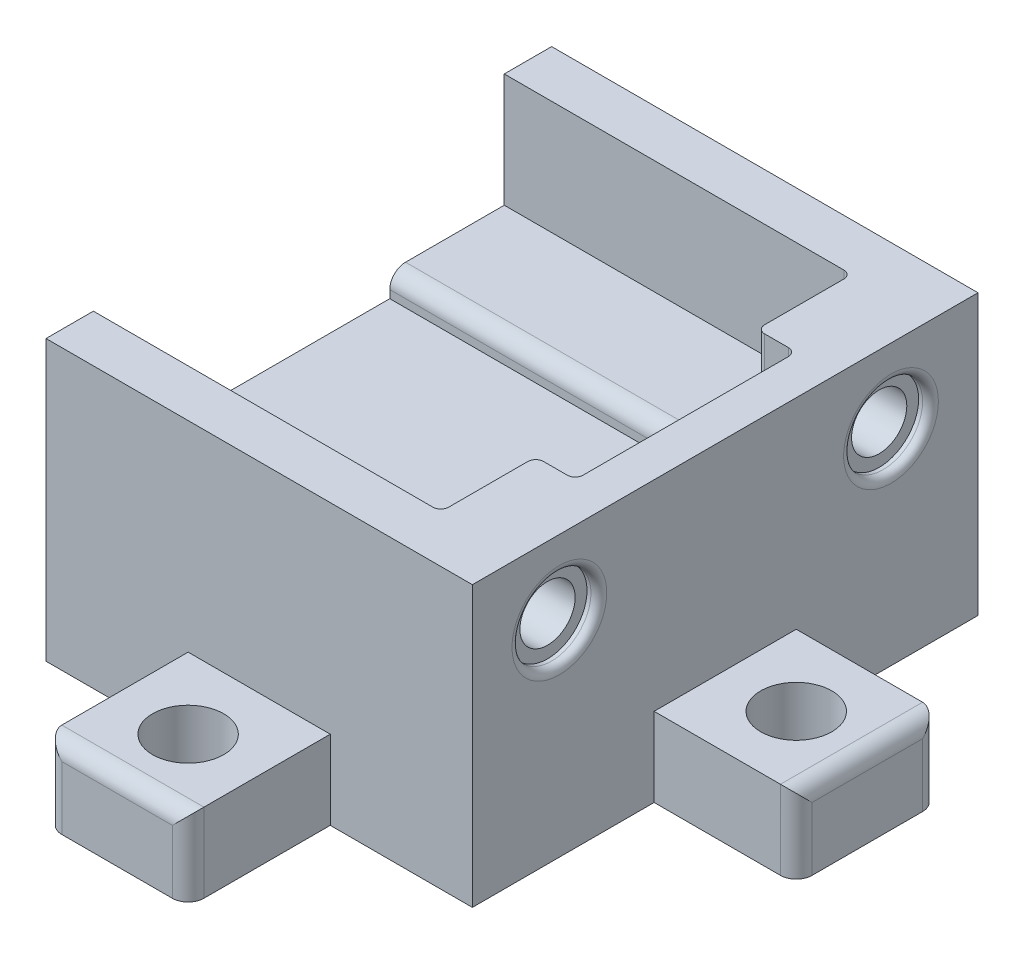
from build123d import *

# Parameters (mm, degrees)
BOSS_EXTRUDE1_DEPTH = 11
SKETCH3_W           = 22
SKETCH3_H           = 3
BOSS_EXTRUDE2_DEPTH = 17.7
BOSS_EXTRUDE3_DEPTH = 5
SKETCH5_R           = 1.75
CUT_EXTRUDE1_DEPTH  = 37.035744466
SKETCH6_W           = 9
SKETCH6_H           = 9
BOSS_EXTRUDE4_DEPTH = 5
SKETCH7_R           = 2.25
CUT_EXTRUDE2_DEPTH  = 38.573063213
FILLET1_R           = 1
SKETCH8_R           = 2.5
CUT_EXTRUDE3_DEPTH  = 0.75
FILLET2_R           = 0.5
SKETCH10_W          = 14
SKETCH10_H          = 7.2
CUT_EXTRUDE4_DEPTH  = 2.5
FILLET3_R           = 0.5


with BuildPart() as part:
    # Sketch1 → Boss-Extrude1 (new, symmetric)
    with BuildSketch(Plane(origin=(0, 0, 0), x_dir=(0, 0, -1), z_dir=(1, 0, 0))):
        Polygon((-13.0089, 0), (13.0089, 0), (13.0089, 10.5), (5.7589, 10.5), (5.7589, 9), (-5.7589, 9), (-5.7589, 10.5), (-13.0089, 10.5), align=None)
    extrude(amount=BOSS_EXTRUDE1_DEPTH, both=True)

    # Sketch3 → Boss-Extrude2 (add)
    with BuildSketch(Plane.XZ):
        with Locations((0, -14.5089)):
            Rectangle(SKETCH3_W, SKETCH3_H)
        with Locations((0, 14.5089)):
            Rectangle(SKETCH3_W, SKETCH3_H)
    extrude(amount=-BOSS_EXTRUDE2_DEPTH)

    # Sketch4 → Boss-Extrude3 (add)
    with BuildSketch(Plane(origin=(11, 0, 0), x_dir=(0, 0, -1), z_dir=(1, 0, 0))):
        Polygon((-8.8, 17.7), (-16.0089, 17.7), (-16.0089, 0), (16.0089, 0), (16.0089, 17.7), align=None)
    extrude(amount=BOSS_EXTRUDE3_DEPTH)

    # Sketch5 → Cut-Extrude1 (cut, through all)
    with BuildSketch(Plane(origin=(16, 0, 0), x_dir=(0, 0, -1), z_dir=(1, 0, 0))):
        with Locations((-10.5, 13)):
            Circle(SKETCH5_R)
        with Locations((10.5, 13)):
            Circle(SKETCH5_R)
    extrude(amount=-CUT_EXTRUDE1_DEPTH, mode=Mode.SUBTRACT)

    # Sketch6 → Boss-Extrude4 (add)
    with BuildSketch(Plane.XZ):
        with Locations((20.5, 0)):
            Rectangle(SKETCH6_W, SKETCH6_H)
        with Locations((2.5, 20.5089)):
            Rectangle(SKETCH6_W, SKETCH6_H)
    extrude(amount=-BOSS_EXTRUDE4_DEPTH)

    # Sketch7 → Cut-Extrude2 (cut, through all)
    with BuildSketch(Plane(origin=(0, 5, 0), x_dir=(1, 0, 0), z_dir=(0, 1, 0))):
        with Locations(Location((20.5, 0, 0), (0, 0, 270))):
            Circle(SKETCH7_R)
        with Locations(Location((2.5, -20.5089, 0), (0, 0, 270))):
            Circle(SKETCH7_R)
    extrude(amount=-CUT_EXTRUDE2_DEPTH, mode=Mode.SUBTRACT)

    # Fillet1
    fillet1_edges = [part.edges().sort_by_distance(p)[0] for p in [
        (0, 10.5, 5.7589),
        (0, 10.5, -5.7589),
        (25, 5, 0),
        (25, 2.5, 4.5),
        (25, 2.5, -4.5),
        (7, 2.5, 25.0089),
        (2.5, 5, 25.0089),
        (-2, 2.5, 25.0089),
    ]]
    fillet(fillet1_edges, radius=FILLET1_R)

    # Sketch8 → Cut-Extrude3 (cut)
    with BuildSketch(Plane(origin=(16, 0, 0), x_dir=(0, 0, -1), z_dir=(1, 0, 0))):
        with Locations((-10.5, 13)):
            Circle(SKETCH8_R)
        with Locations((10.5, 13)):
            Circle(SKETCH8_R)
    extrude(amount=-CUT_EXTRUDE3_DEPTH, mode=Mode.SUBTRACT)

    # Fillet2
    fillet2_edges = [part.edges().sort_by_distance(p)[0] for p in [
        (16, 13, 13),
        (16, 13, -8),
    ]]
    fillet(fillet2_edges, radius=FILLET2_R)

    # Sketch10 → Cut-Extrude4 (cut)
    with BuildSketch(Plane.ZY.offset(-11)):
        with Locations((0, 14.1)):
            Rectangle(SKETCH10_W, SKETCH10_H)
    extrude(amount=-CUT_EXTRUDE4_DEPTH, mode=Mode.SUBTRACT)

    # Fillet3
    fillet3_edges = [part.edges().sort_by_distance(p)[0] for p in [
        (13.5, 14.1, -7),
        (13.5, 14.1, 7),
        (11, 14.1, -7),
        (11, 14.1, 7),
        (11, 14.1, -13.0089),
        (11, 14.1, 13.0089),
    ]]
    fillet(fillet3_edges, radius=FILLET3_R)


solid = part.part
